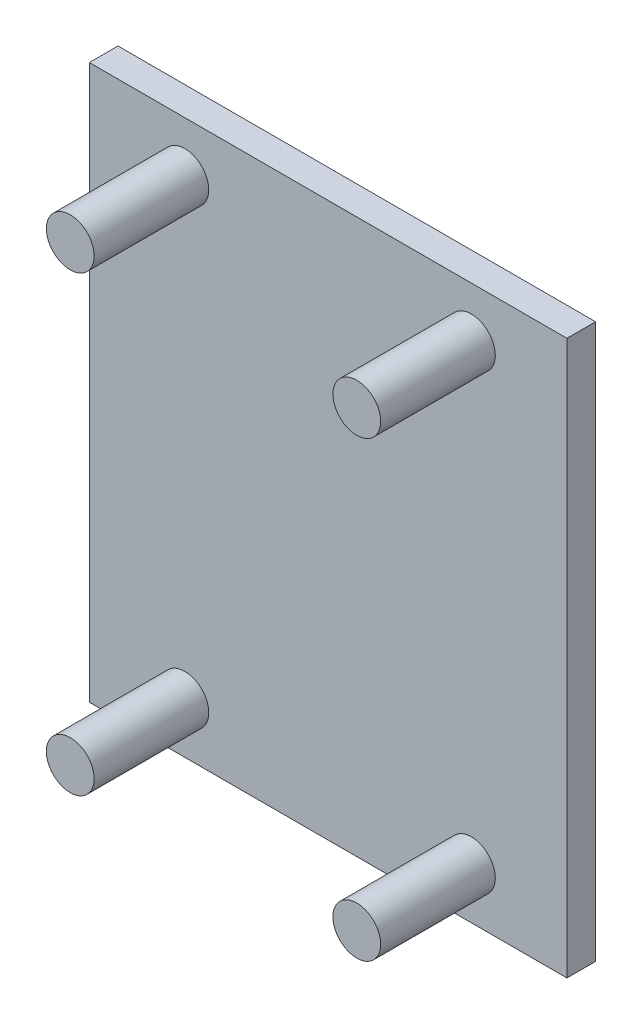
from build123d import *

# Parameters (mm, degrees)
SKETCH_1_W         = 50
SKETCH_1_H         = 58
FORMER_BASE_DEPTH  = 3
FORMER_POSTS_START = 3
SKETCH_2_R         = 2.5
FORMER_POSTS_DEPTH = 12


with BuildPart() as part:
    # Эскиз1 → Former_base (new body)
    with BuildSketch(Plane.XY):
        Rectangle(SKETCH_1_W, SKETCH_1_H)
    extrude(amount=FORMER_BASE_DEPTH)

    # Эскиз2 → Former_posts (add)
    with BuildSketch(Plane.XY.offset(FORMER_POSTS_START)):
        with Locations((-15, -23.7)):
            Circle(SKETCH_2_R)
        with Locations((-15, 23.7)):
            Circle(SKETCH_2_R)
        with Locations((15, -23.7)):
            Circle(SKETCH_2_R)
        with Locations((15, 23.7)):
            Circle(SKETCH_2_R)
    extrude(amount=FORMER_POSTS_DEPTH)


solid = part.part
